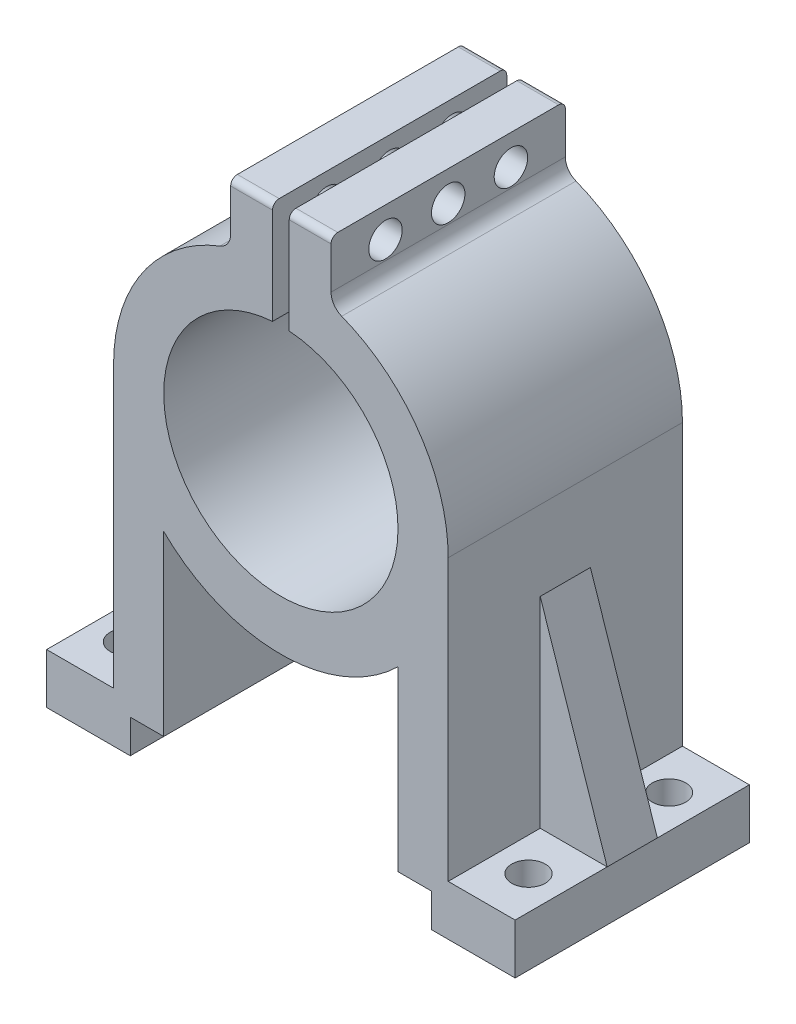
from build123d import *
from build123d.topology import SkipClean

# Parameters (mm, degrees)
BOSS_EXTRUDE1_DEPTH = 7
SKETCH3_R           = 1
CUT_EXTRUDE1_DEPTH  = 10
RIB1_REACH          = 27.202
SKETCH2_WALL_W      = 65.053025346
SKETCH2_WALL_H      = 3
BOSS_EXTRUDE2_DEPTH = 7
SKETCH5_R           = 1
CUT_EXTRUDE2_DEPTH  = 14
FILLET1_R           = 1
FILLET2_R           = 0.4
SKETCH6_W           = 2
SKETCH6_H           = 4.221802259
CUT_EXTRUDE3_DEPTH  = 28.966741934
SKETCH7_W           = 1
SKETCH7_H           = 18.119739654
CUT_EXTRUDE4_DEPTH  = 28.966741934


with BuildPart() as part:
    # Sketch1 → Boss-Extrude1 (new, symmetric)
    with BuildSketch(Plane.XY):
        with BuildLine():
            Line((0, 10), (0, 7))
            ThreePointArc((0, 7), (7, 0), (0, -7))
            Line((0, -7), (0, -10))
            ThreePointArc((0, -10), (3.780589618, -9.257815193), (7, -7.141428429))
            Line((7, -7.141428429), (7, -19.751927866))
            Line((7, -19.751927866), (14, -19.751927866))
            Line((14, -19.751927866), (14, -16.751927866))
            Line((14, -16.751927866), (10, -16.751927866))
            Line((10, -16.751927866), (10, 0))
            ThreePointArc((10, 0), (7.071067812, 7.071067812), (0, 10))
        make_face()
    extrude(amount=BOSS_EXTRUDE1_DEPTH, both=True)

    # Sketch3 → Cut-Extrude1 (cut)
    with BuildSketch(Plane(origin=(0, -16.751927866, 0), x_dir=(1, 0, 0), z_dir=(0, 1, 0))):
        with Locations(Location((12, -4.2, 0), (0, 0, 270))):
            Circle(SKETCH3_R)
        with Locations(Location((12, 4.2, 0), (0, 0, 270))):
            Circle(SKETCH3_R)
    extrude(amount=-CUT_EXTRUDE1_DEPTH, mode=Mode.SUBTRACT)

    # Sketch2 wall → Rib1 (add, up to next)
    with BuildSketch(Plane(origin=(12, -10.751927866, 0), x_dir=(-0.316227766017, 0.948683298051, 0), z_dir=(-0.948683298051, -0.316227766017, 0)), mode=Mode.PRIVATE) as rib1_sk1:
        Rectangle(SKETCH2_WALL_W, SKETCH2_WALL_H)
    rib1_tool1 = extrude(rib1_sk1.sketch, amount=RIB1_REACH, mode=Mode.PRIVATE) - part.part
    add(rib1_tool1.solids().sort_by_distance((12, -10.751927866, 0))[0])

    # Sketch4 → Boss-Extrude2 (add, symmetric)
    with BuildSketch(Plane.XY):
        with BuildLine():
            Line((0, 10), (0, 13.139392014))
            Line((0, 13.139392014), (3, 13.139392014))
            Line((3, 13.139392014), (3, 9.539392014))
            ThreePointArc((3, 9.539392014), (1.517576993, 9.884177258), (0, 10))
        make_face()
    extrude(amount=BOSS_EXTRUDE2_DEPTH, both=True)

    # Sketch5 → Cut-Extrude2 (cut)
    with BuildSketch(Plane(origin=(3, 0, 0), x_dir=(0, 0, -1), z_dir=(1, 0, 0))):
        with Locations((-3.75, 11.339392014)):
            Circle(SKETCH5_R)
        with Locations((0, 11.339392014)):
            Circle(SKETCH5_R)
        with Locations((3.75, 11.339392014)):
            Circle(SKETCH5_R)
    extrude(amount=-CUT_EXTRUDE2_DEPTH, mode=Mode.SUBTRACT)

    # Fillet1
    fillet1_edges = [part.edges().sort_by_distance(p)[0] for p in [
        (3, 9.539392014, 0),
    ]]
    fillet(fillet1_edges, radius=FILLET1_R)

    # Fillet2
    fillet2_edges = [part.edges().sort_by_distance(p)[0] for p in [
        (1.5, 13.139392014, -7),
        (1.5, 13.139392014, 7),
    ]]
    fillet(fillet2_edges, radius=FILLET2_R)

    # Sketch6 → Cut-Extrude3 (cut, through all)
    with BuildSketch(Plane.XY.offset(7)):
        with Locations((8, -19.862828996)):
            Rectangle(SKETCH6_W, SKETCH6_H)
    extrude(amount=-CUT_EXTRUDE3_DEPTH, mode=Mode.SUBTRACT)

    # Mirror1: part across plane


with BuildPart() as part_1:
    with SkipClean():  # the faces are left unmerged after this step: merging them gives an invalid solid
        add(part.part)
        add(part.part.mirror(Plane(origin=(0, 0, 0), x_dir=(0, 0, 1), z_dir=(1, 0, 0))))

    # Sketch7 → Cut-Extrude4 (cut, through all)
    with BuildSketch(Plane.XY.offset(7)):
        with Locations((0, 9.869696007)):
            Rectangle(SKETCH7_W, SKETCH7_H)
    extrude(amount=-CUT_EXTRUDE4_DEPTH, mode=Mode.SUBTRACT)


solid = part_1.part
